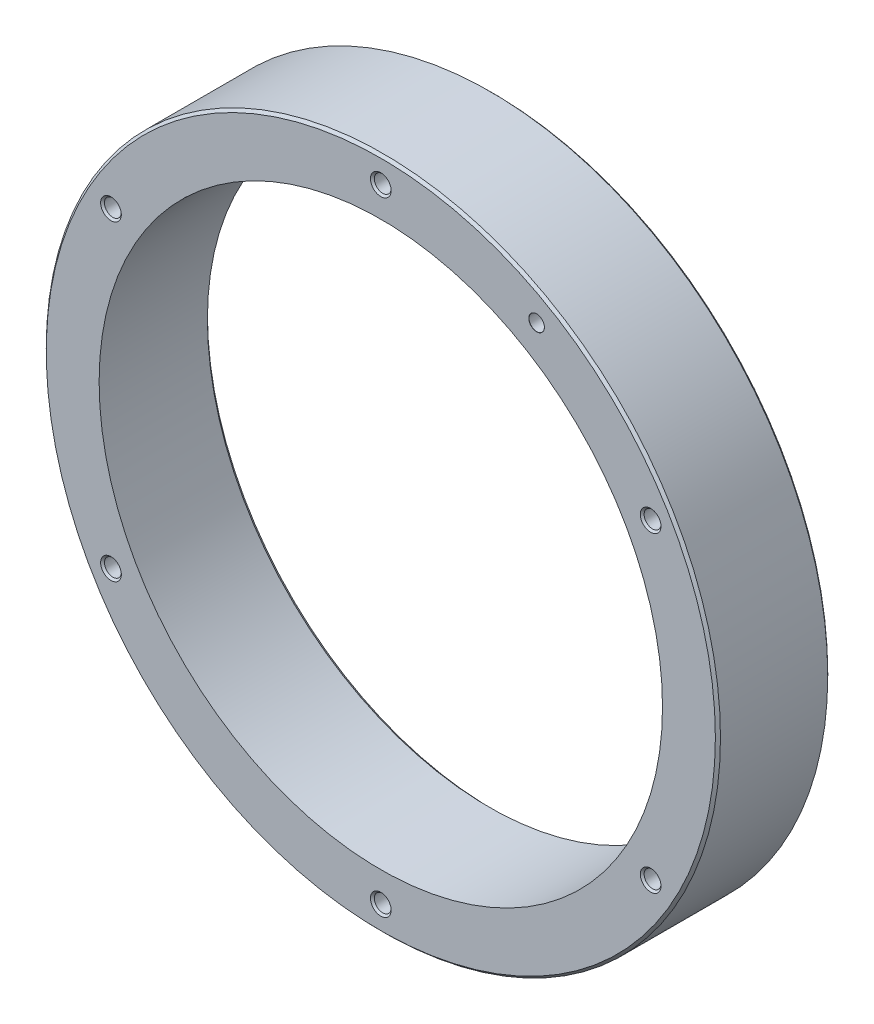
from build123d import *

# Parameters (mm, degrees)
SKETCH1_R                       = 66
SKETCH1_R_2                     = 55.15
COLLAR_BODY_DEPTH               = 22
M4PATTERN_COUNT                 = 6
F_3_0MM_DOWEL_HOLE5_D           = 3
F_3_0MM_DOWEL_HOLE5_DEPTH       = 7
F_3_0MM_DOWEL_HOLE5_CSINK_D     = 3.05
F_3_0MM_DOWEL_HOLE5_CSINK_ANGLE = 90
F_3_0MM_DOWEL_HOLE5_TIP         = 0.901290929
CHAMFER1_SIZE                   = 0.5
CHAMFER2_SIZE                   = 0.8


with BuildPart() as part:
    # Sketch1 → Collar_Body (new body)
    with BuildSketch(Plane.XY):
        Circle(SKETCH1_R)
        Circle(SKETCH1_R_2, mode=Mode.SUBTRACT)
    extrude(amount=-COLLAR_BODY_DEPTH)

    # Sketch5 → M4x0.7 Bottoming Tapped Hole1 (revolve, cut)
    with BuildSketch(Plane(origin=(0, 61, 0), x_dir=(0, -1, 0), z_dir=(1, 0, 0))):
        Polygon((0, 0), (0, 11.991420021), (1.65, 11), (1.65, 0.375), (2.025, 0), align=None)
    m4x0_7_bottoming_tapped_hole1 = revolve(axis=Axis((0, 61, 6.35), (0, 0, -1)), mode=Mode.SUBTRACT)

    # M4pattern: M4x0.7 Bottoming Tapped Hole1 ×6 about axis
    m4pattern_axis = Axis((0, 0, 0), (0, 0, 1))
    for i in range(1, M4PATTERN_COUNT):
        add(m4x0_7_bottoming_tapped_hole1.rotate(m4pattern_axis, i * 360 / M4PATTERN_COUNT), mode=Mode.SUBTRACT)

    # Ø3.0mm Dowel Hole5
    with Locations(Plane.XY):
        with Locations((30.5, 52.827549631)):
            CounterSinkHole(F_3_0MM_DOWEL_HOLE5_D / 2, F_3_0MM_DOWEL_HOLE5_CSINK_D / 2, depth=F_3_0MM_DOWEL_HOLE5_DEPTH, counter_sink_angle=F_3_0MM_DOWEL_HOLE5_CSINK_ANGLE)
            with Locations((0, 0, -(F_3_0MM_DOWEL_HOLE5_DEPTH + F_3_0MM_DOWEL_HOLE5_TIP / 2))):  # 118° drill point
                Cone(0, F_3_0MM_DOWEL_HOLE5_D / 2, F_3_0MM_DOWEL_HOLE5_TIP, mode=Mode.SUBTRACT)

    # Chamfer1
    chamfer1_edges = [part.edges().sort_by_distance(p)[0] for p in [
        (-66, 0, 0),
        (-66, 0, -22),
    ]]
    chamfer(chamfer1_edges, length=CHAMFER1_SIZE)

    # Chamfer2
    chamfer2_edges = [part.edges().sort_by_distance(p)[0] for p in [
        (-55.15, 0, -22),
    ]]
    chamfer(chamfer2_edges, length=CHAMFER2_SIZE)


solid = part.part
